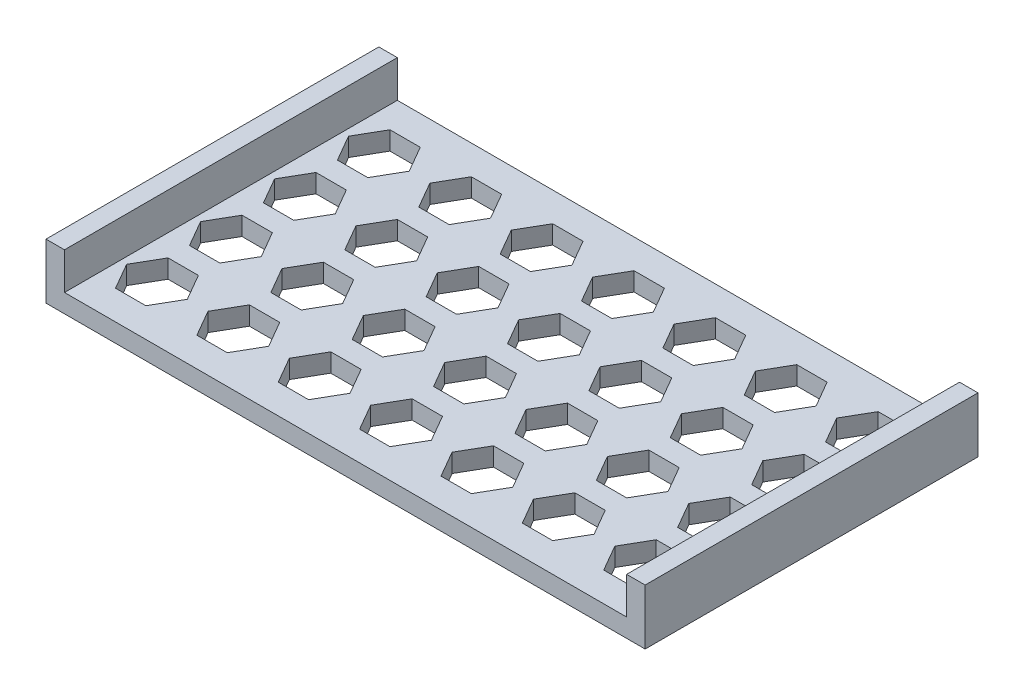
from build123d import *

# Parameters (mm, degrees)
SKETCH1_W               = 162
SKETCH1_H               = 90
BOSS_EXTRUDE1_DEPTH     = 5
SKETCH2_W               = 5
SKETCH2_H               = 90
BOSS_EXTRUDE2_DEPTH     = 10
CUT_EXTRUDE1_DEPTH      = 10
LPATTERN2_COUNT         = 7
LPATTERN2_PITCH         = 22
LPATTERN3_COUNT         = 4
LPATTERN3_PITCH         = 20
LPATTERN3_COPY_1_DEPTH  = 10
LPATTERN3_COPY_2_DEPTH  = 10
LPATTERN3_COPY_3_DEPTH  = 10
LPATTERN3_COPY_4_DEPTH  = 10
LPATTERN3_COPY_5_DEPTH  = 10
LPATTERN3_COPY_6_DEPTH  = 10
LPATTERN3_COPY_7_DEPTH  = 10
LPATTERN3_COPY_8_DEPTH  = 10
LPATTERN3_COPY_9_DEPTH  = 10
LPATTERN3_COPY_10_DEPTH = 10
LPATTERN3_COPY_11_DEPTH = 10
LPATTERN3_COPY_12_DEPTH = 10
LPATTERN3_COPY_13_DEPTH = 10
LPATTERN3_COPY_14_DEPTH = 10
LPATTERN3_COPY_15_DEPTH = 10
LPATTERN3_COPY_16_DEPTH = 10
LPATTERN3_COPY_17_DEPTH = 10
LPATTERN3_COPY_18_DEPTH = 10


with BuildPart() as part:
    # Sketch1 → Boss-Extrude1 (new body)
    with BuildSketch(Plane(origin=(0, 0, 0), x_dir=(1, 0, 0), z_dir=(0, 1, 0))):
        with Locations((-143.654199905, 113.165491501)):
            Rectangle(SKETCH1_W, SKETCH1_H)
    extrude(amount=BOSS_EXTRUDE1_DEPTH)

    # Sketch2 → Boss-Extrude2 (add)
    with BuildSketch(Plane(origin=(0, 5, 0), x_dir=(1, 0, 0), z_dir=(0, 1, 0))):
        with Locations((-222.154199905, 113.165491501)):
            Rectangle(SKETCH2_W, SKETCH2_H)
        with Locations((-65.154199905, 113.165491501)):
            Rectangle(SKETCH2_W, SKETCH2_H)
    extrude(amount=BOSS_EXTRUDE2_DEPTH)

    # Sketch3 → Cut-Extrude1 (cut)
    with BuildSketch(Plane(origin=(0, 0, 0), x_dir=(-1, 0, 0), z_dir=(0, -1, 0))):
        Polygon((217.854199905, 83.165491501), (213.754199905, 90.266899812), (205.554199905, 90.266899812), (201.454199905, 83.165491501), (205.554199905, 76.06408319), (213.754199905, 76.06408319), align=None)
    cut_extrude1 = extrude(amount=-CUT_EXTRUDE1_DEPTH, mode=Mode.SUBTRACT)

    # LPattern2: Cut-Extrude1 ×7
    with Locations(*[(i * LPATTERN2_PITCH, 0, 0) for i in range(1, LPATTERN2_COUNT)]):
        add(cut_extrude1, mode=Mode.SUBTRACT)

    # LPattern3: Cut-Extrude1 ×4
    with Locations(*[(0, 0, -i * LPATTERN3_PITCH) for i in range(1, LPATTERN3_COUNT)]):
        add(cut_extrude1, mode=Mode.SUBTRACT)

    # LPattern3 copy 1 sketch → LPattern3 copy 1 (cut)
    with BuildSketch(Plane(origin=(22, 0, -20), x_dir=(-1, 0, 0), z_dir=(0, -1, 0))):
        Polygon((217.854199905, 83.165491501), (213.754199905, 90.266899812), (205.554199905, 90.266899812), (201.454199905, 83.165491501), (205.554199905, 76.06408319), (213.754199905, 76.06408319), align=None)
    extrude(amount=-LPATTERN3_COPY_1_DEPTH, mode=Mode.SUBTRACT)

    # LPattern3 copy 2 sketch → LPattern3 copy 2 (cut)
    with BuildSketch(Plane(origin=(22, 0, -40), x_dir=(-1, 0, 0), z_dir=(0, -1, 0))):
        Polygon((217.854199905, 83.165491501), (213.754199905, 90.266899812), (205.554199905, 90.266899812), (201.454199905, 83.165491501), (205.554199905, 76.06408319), (213.754199905, 76.06408319), align=None)
    extrude(amount=-LPATTERN3_COPY_2_DEPTH, mode=Mode.SUBTRACT)

    # LPattern3 copy 3 sketch → LPattern3 copy 3 (cut)
    with BuildSketch(Plane(origin=(22, 0, -60), x_dir=(-1, 0, 0), z_dir=(0, -1, 0))):
        Polygon((217.854199905, 83.165491501), (213.754199905, 90.266899812), (205.554199905, 90.266899812), (201.454199905, 83.165491501), (205.554199905, 76.06408319), (213.754199905, 76.06408319), align=None)
    extrude(amount=-LPATTERN3_COPY_3_DEPTH, mode=Mode.SUBTRACT)

    # LPattern3 copy 4 sketch → LPattern3 copy 4 (cut)
    with BuildSketch(Plane(origin=(44, 0, -20), x_dir=(-1, 0, 0), z_dir=(0, -1, 0))):
        Polygon((217.854199905, 83.165491501), (213.754199905, 90.266899812), (205.554199905, 90.266899812), (201.454199905, 83.165491501), (205.554199905, 76.06408319), (213.754199905, 76.06408319), align=None)
    extrude(amount=-LPATTERN3_COPY_4_DEPTH, mode=Mode.SUBTRACT)

    # LPattern3 copy 5 sketch → LPattern3 copy 5 (cut)
    with BuildSketch(Plane(origin=(44, 0, -40), x_dir=(-1, 0, 0), z_dir=(0, -1, 0))):
        Polygon((217.854199905, 83.165491501), (213.754199905, 90.266899812), (205.554199905, 90.266899812), (201.454199905, 83.165491501), (205.554199905, 76.06408319), (213.754199905, 76.06408319), align=None)
    extrude(amount=-LPATTERN3_COPY_5_DEPTH, mode=Mode.SUBTRACT)

    # LPattern3 copy 6 sketch → LPattern3 copy 6 (cut)
    with BuildSketch(Plane(origin=(44, 0, -60), x_dir=(-1, 0, 0), z_dir=(0, -1, 0))):
        Polygon((217.854199905, 83.165491501), (213.754199905, 90.266899812), (205.554199905, 90.266899812), (201.454199905, 83.165491501), (205.554199905, 76.06408319), (213.754199905, 76.06408319), align=None)
    extrude(amount=-LPATTERN3_COPY_6_DEPTH, mode=Mode.SUBTRACT)

    # LPattern3 copy 7 sketch → LPattern3 copy 7 (cut)
    with BuildSketch(Plane(origin=(66, 0, -20), x_dir=(-1, 0, 0), z_dir=(0, -1, 0))):
        Polygon((217.854199905, 83.165491501), (213.754199905, 90.266899812), (205.554199905, 90.266899812), (201.454199905, 83.165491501), (205.554199905, 76.06408319), (213.754199905, 76.06408319), align=None)
    extrude(amount=-LPATTERN3_COPY_7_DEPTH, mode=Mode.SUBTRACT)

    # LPattern3 copy 8 sketch → LPattern3 copy 8 (cut)
    with BuildSketch(Plane(origin=(66, 0, -40), x_dir=(-1, 0, 0), z_dir=(0, -1, 0))):
        Polygon((217.854199905, 83.165491501), (213.754199905, 90.266899812), (205.554199905, 90.266899812), (201.454199905, 83.165491501), (205.554199905, 76.06408319), (213.754199905, 76.06408319), align=None)
    extrude(amount=-LPATTERN3_COPY_8_DEPTH, mode=Mode.SUBTRACT)

    # LPattern3 copy 9 sketch → LPattern3 copy 9 (cut)
    with BuildSketch(Plane(origin=(66, 0, -60), x_dir=(-1, 0, 0), z_dir=(0, -1, 0))):
        Polygon((217.854199905, 83.165491501), (213.754199905, 90.266899812), (205.554199905, 90.266899812), (201.454199905, 83.165491501), (205.554199905, 76.06408319), (213.754199905, 76.06408319), align=None)
    extrude(amount=-LPATTERN3_COPY_9_DEPTH, mode=Mode.SUBTRACT)

    # LPattern3 copy 10 sketch → LPattern3 copy 10 (cut)
    with BuildSketch(Plane(origin=(88, 0, -20), x_dir=(-1, 0, 0), z_dir=(0, -1, 0))):
        Polygon((217.854199905, 83.165491501), (213.754199905, 90.266899812), (205.554199905, 90.266899812), (201.454199905, 83.165491501), (205.554199905, 76.06408319), (213.754199905, 76.06408319), align=None)
    extrude(amount=-LPATTERN3_COPY_10_DEPTH, mode=Mode.SUBTRACT)

    # LPattern3 copy 11 sketch → LPattern3 copy 11 (cut)
    with BuildSketch(Plane(origin=(88, 0, -40), x_dir=(-1, 0, 0), z_dir=(0, -1, 0))):
        Polygon((217.854199905, 83.165491501), (213.754199905, 90.266899812), (205.554199905, 90.266899812), (201.454199905, 83.165491501), (205.554199905, 76.06408319), (213.754199905, 76.06408319), align=None)
    extrude(amount=-LPATTERN3_COPY_11_DEPTH, mode=Mode.SUBTRACT)

    # LPattern3 copy 12 sketch → LPattern3 copy 12 (cut)
    with BuildSketch(Plane(origin=(88, 0, -60), x_dir=(-1, 0, 0), z_dir=(0, -1, 0))):
        Polygon((217.854199905, 83.165491501), (213.754199905, 90.266899812), (205.554199905, 90.266899812), (201.454199905, 83.165491501), (205.554199905, 76.06408319), (213.754199905, 76.06408319), align=None)
    extrude(amount=-LPATTERN3_COPY_12_DEPTH, mode=Mode.SUBTRACT)

    # LPattern3 copy 13 sketch → LPattern3 copy 13 (cut)
    with BuildSketch(Plane(origin=(110, 0, -20), x_dir=(-1, 0, 0), z_dir=(0, -1, 0))):
        Polygon((217.854199905, 83.165491501), (213.754199905, 90.266899812), (205.554199905, 90.266899812), (201.454199905, 83.165491501), (205.554199905, 76.06408319), (213.754199905, 76.06408319), align=None)
    extrude(amount=-LPATTERN3_COPY_13_DEPTH, mode=Mode.SUBTRACT)

    # LPattern3 copy 14 sketch → LPattern3 copy 14 (cut)
    with BuildSketch(Plane(origin=(110, 0, -40), x_dir=(-1, 0, 0), z_dir=(0, -1, 0))):
        Polygon((217.854199905, 83.165491501), (213.754199905, 90.266899812), (205.554199905, 90.266899812), (201.454199905, 83.165491501), (205.554199905, 76.06408319), (213.754199905, 76.06408319), align=None)
    extrude(amount=-LPATTERN3_COPY_14_DEPTH, mode=Mode.SUBTRACT)

    # LPattern3 copy 15 sketch → LPattern3 copy 15 (cut)
    with BuildSketch(Plane(origin=(110, 0, -60), x_dir=(-1, 0, 0), z_dir=(0, -1, 0))):
        Polygon((217.854199905, 83.165491501), (213.754199905, 90.266899812), (205.554199905, 90.266899812), (201.454199905, 83.165491501), (205.554199905, 76.06408319), (213.754199905, 76.06408319), align=None)
    extrude(amount=-LPATTERN3_COPY_15_DEPTH, mode=Mode.SUBTRACT)

    # LPattern3 copy 16 sketch → LPattern3 copy 16 (cut)
    with BuildSketch(Plane(origin=(132, 0, -20), x_dir=(-1, 0, 0), z_dir=(0, -1, 0))):
        Polygon((217.854199905, 83.165491501), (213.754199905, 90.266899812), (205.554199905, 90.266899812), (201.454199905, 83.165491501), (205.554199905, 76.06408319), (213.754199905, 76.06408319), align=None)
    extrude(amount=-LPATTERN3_COPY_16_DEPTH, mode=Mode.SUBTRACT)

    # LPattern3 copy 17 sketch → LPattern3 copy 17 (cut)
    with BuildSketch(Plane(origin=(132, 0, -40), x_dir=(-1, 0, 0), z_dir=(0, -1, 0))):
        Polygon((217.854199905, 83.165491501), (213.754199905, 90.266899812), (205.554199905, 90.266899812), (201.454199905, 83.165491501), (205.554199905, 76.06408319), (213.754199905, 76.06408319), align=None)
    extrude(amount=-LPATTERN3_COPY_17_DEPTH, mode=Mode.SUBTRACT)

    # LPattern3 copy 18 sketch → LPattern3 copy 18 (cut)
    with BuildSketch(Plane(origin=(132, 0, -60), x_dir=(-1, 0, 0), z_dir=(0, -1, 0))):
        Polygon((217.854199905, 83.165491501), (213.754199905, 90.266899812), (205.554199905, 90.266899812), (201.454199905, 83.165491501), (205.554199905, 76.06408319), (213.754199905, 76.06408319), align=None)
    extrude(amount=-LPATTERN3_COPY_18_DEPTH, mode=Mode.SUBTRACT)


solid = part.part
